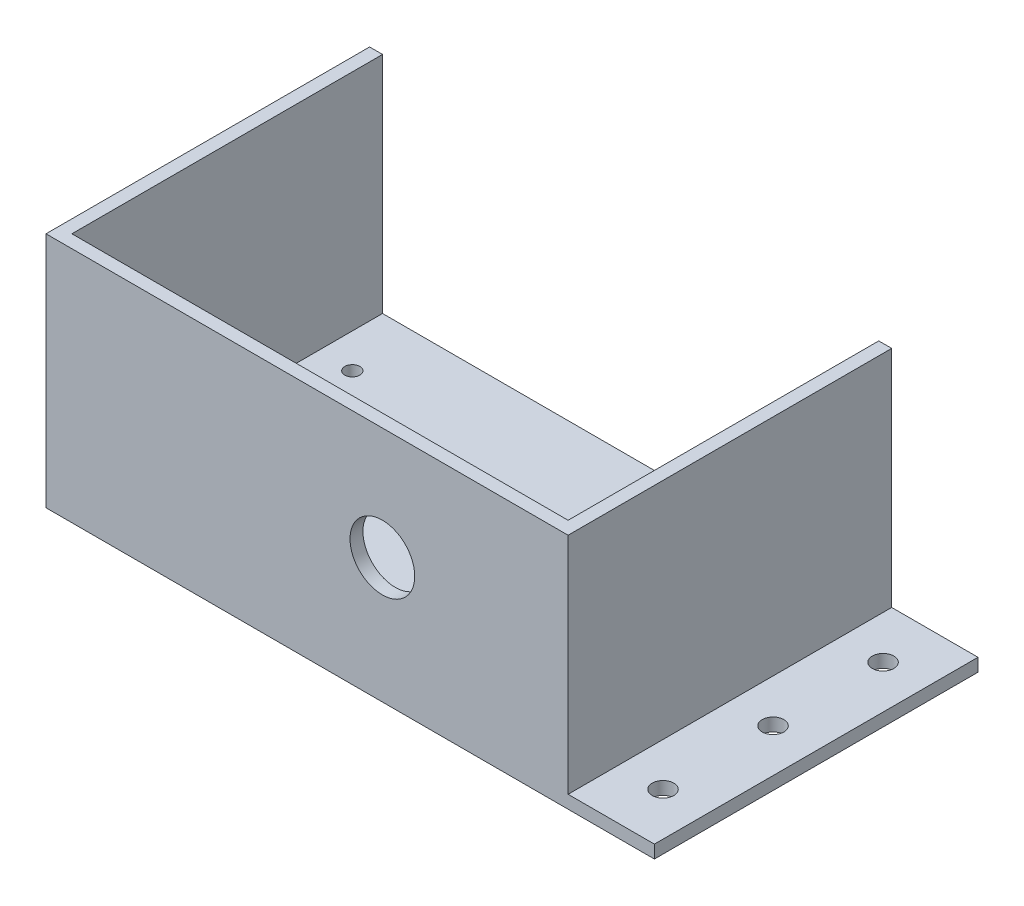
from build123d import *

# Parameters (mm, degrees)
SKETCH1_W           = 121
SKETCH1_H           = 75
BOSS_EXTRUDE1_DEPTH = 58
SKETCH2_W           = 115
SKETCH2_H           = 53
CUT_EXTRUDE1_DEPTH  = 72
SKETCH4_W           = 1.41025641
SKETCH4_H           = 10
BOSS_EXTRUDE2_DEPTH = 1.5
SKETCH5_R           = 1.489811861
SKETCH5_R_2         = 1.5
CUT_EXTRUDE2_DEPTH  = 5
SKETCH6_W           = 75
SKETCH6_H           = 3
BOSS_EXTRUDE3_DEPTH = 20
SKETCH7_R           = 2.5
CUT_EXTRUDE3_DEPTH  = 20
SKETCH8_R           = 7.5
CUT_EXTRUDE4_DEPTH  = 5
SKETCH9_R           = 1.75
CUT_EXTRUDE5_DEPTH  = 5
SKETCH10_W          = 121
SKETCH10_H          = 10.055013608
CUT_EXTRUDE6_DEPTH  = 171.429604315


with BuildPart() as part:
    # Sketch1 → Boss-Extrude1 (new body)
    with BuildSketch(Plane(origin=(0, 0, 0), x_dir=(1, 0, 0), z_dir=(0, 1, 0))):
        with Locations((60.5, 37.5)):
            Rectangle(SKETCH1_W, SKETCH1_H)
    extrude(amount=BOSS_EXTRUDE1_DEPTH)

    # Sketch2 → Cut-Extrude1 (cut)
    with BuildSketch(Plane(origin=(0, 0, -75), x_dir=(-1, 0, 0), z_dir=(0, 0, -1))):
        with Locations((-60.5, 29.5)):
            Rectangle(SKETCH2_W, SKETCH2_H)
    extrude(amount=-CUT_EXTRUDE1_DEPTH, mode=Mode.SUBTRACT)

    # Sketch4 → Boss-Extrude2 (add)
    # profile 1 of 9: a face of its own
    with BuildSketch(Plane(origin=(0, 58, 0), x_dir=(1, 0, 0), z_dir=(0, 1, 0))):
        with Locations((16.987179487, 60)):
            Rectangle(SKETCH4_W, SKETCH4_H)
    # profile 2 of 9: a face of its own
    with BuildSketch(Plane(origin=(0, 58, 0), x_dir=(1, 0, 0), z_dir=(0, 1, 0))):
        with BuildLine():
            Line((21.58974359, 55), (21.58974359, 65))
            Line((21.58974359, 65), (23.711137821, 65))
            Line((23.711137821, 65), (25.946714744, 57.982772436))
            add(Edge.make_bspline(
                [(25.946714744, 57.982772436), (25.971317363, 57.903279477), (26.018897396, 57.749544721), (26.08945294, 57.527537588), (26.153646657, 57.321231721), (26.211463207, 57.129970438), (26.266025433, 56.954703341), (26.313267723, 56.793992236), (26.358432889, 56.649622979), (26.384901695, 56.557871596), (26.397435897, 56.514423077)],
                knots=[0, 0, 0, 0, 1.300204174, 2.514519184, 3.639827924, 4.676153899, 5.636536826, 6.507959918, 7.293450077, 8, 8, 8, 8], degree=3))
            add(Edge.make_bspline(
                [(26.397435897, 56.514423077), (26.411396089, 56.561850935), (26.441104268, 56.662780451), (26.489265976, 56.821474812), (26.540511404, 56.997087981), (26.601836474, 57.186601452), (26.665760601, 57.392988098), (26.732857292, 57.61607652), (26.810252019, 57.853639448), (26.861684683, 58.018107915), (26.888221154, 58.102964744)],
                knots=[0, 0, 0, 0, 0.713638162, 1.518667645, 2.393860736, 3.354087503, 4.393659122, 5.512594909, 6.716633584, 8, 8, 8, 8], degree=3))
            Line((26.888221154, 58.102964744), (29.101762821, 65))
            Line((29.101762821, 65), (31.205128205, 65))
            Line((31.205128205, 65), (31.205128205, 55))
            Line((31.205128205, 55), (29.794871795, 55))
            Line((29.794871795, 55), (29.794871795, 63.461538462))
            Line((29.794871795, 63.461538462), (27.126602564, 55))
            Line((27.126602564, 55), (25.65224359, 55))
            Line((25.65224359, 55), (23, 63.461538462))
            Line((23, 63.461538462), (23, 55))
            Line((23, 55), (21.58974359, 55))
        make_face()
    # profile 3 of 9: a face of its own
    with BuildSketch(Plane(origin=(0, 58, 0), x_dir=(1, 0, 0), z_dir=(0, 1, 0))):
        Polygon((33.734375, 55), (37.704727564, 65), (39.295272436, 65), (43.265625, 55), (41.769230769, 55), (40.631410256, 58.076923077), (36.368589744, 58.076923077), (35.230769231, 55), align=None)
        with BuildLine():
            Line((36.793269231, 59.230769231), (40.206730769, 59.230769231))
            Line((40.206730769, 59.230769231), (39.235176282, 61.858974359))
            add(Edge.make_bspline(
                [(39.235176282, 61.858974359), (39.197930352, 61.960524623), (39.125107525, 62.159074565), (39.016506752, 62.447550868), (38.917290835, 62.721499806), (38.820001481, 62.976993344), (38.732176644, 63.217742781), (38.65122624, 63.442121964), (38.571166974, 63.648571351), (38.523122282, 63.781958927), (38.5, 63.846153846)],
                knots=[0, 0, 0, 0, 1.225184869, 2.395467751, 3.491410812, 4.525364584, 5.492066482, 6.394148129, 7.227157926, 8, 8, 8, 8], degree=3))
            add(Edge.make_bspline(
                [(38.5, 63.846153846), (38.461751283, 63.687854829), (38.385096138, 63.370604078), (38.224598927, 62.905789169), (38.040995692, 62.445225202), (37.891887987, 62.148440925), (37.816907051, 61.999198718)],
                knots=[0, 0, 0, 0, 0.9891762, 1.982431084, 2.985436691, 4, 4, 4, 4], degree=3))
            Line((37.816907051, 61.999198718), (36.793269231, 59.230769231))
        make_face(mode=Mode.SUBTRACT)
    # profile 4 of 9: a face of its own
    with BuildSketch(Plane(origin=(0, 58, 0), x_dir=(1, 0, 0), z_dir=(0, 1, 0))):
        with BuildLine():
            Line((50.794871795, 58.974358974), (50.794871795, 60.128205128))
            Line((50.794871795, 60.128205128), (54.897435897, 60.128205128))
            Line((54.897435897, 60.128205128), (54.897435897, 56.428285256))
            add(Edge.make_bspline(
                [(54.897435897, 56.428285256), (54.73556896, 56.305002849), (54.416994741, 56.062367775), (53.917376037, 55.745937247), (53.409562732, 55.477566549), (52.894958248, 55.256008429), (52.371793817, 55.085009754), (51.842328107, 54.962612928), (51.305984536, 54.885088148), (50.945369884, 54.876229875), (50.764823718, 54.871794872)],
                knots=[0, 0, 0, 0, 1.08433114, 2.134098231, 3.14842993, 4.143565882, 5.117308249, 6.078377492, 7.037916032, 8, 8, 8, 8], degree=3))
            add(Edge.make_bspline(
                [(50.764823718, 54.871794872), (50.64389522, 54.87365123), (50.40366656, 54.877338949), (50.047995823, 54.908887566), (49.700630006, 54.955764326), (49.362227986, 55.024694072), (49.031595068, 55.112449203), (48.709368093, 55.220898845), (48.395411996, 55.347451318), (48.091476855, 55.49253813), (47.802131001, 55.658770426), (47.528170608, 55.841031042), (47.273051762, 56.0420657), (47.036381783, 56.260230047), (46.819016407, 56.496822026), (46.617735084, 56.748697136), (46.437936839, 57.020470861), (46.275651434, 57.307144136), (46.132352841, 57.606547618), (46.007233593, 57.916126264), (45.903810689, 58.235137402), (45.817554604, 58.562169756), (45.748959138, 58.897100071), (45.701047331, 59.240978048), (45.672844116, 59.593540684), (45.668739297, 59.831680225), (45.666666667, 59.951923077)],
                knots=[0, 0, 0, 0, 1.072770755, 2.131096365, 3.165876834, 4.181397123, 5.193125461, 6.199217581, 7.195986042, 8.195005739, 9.184865672, 10.154356418, 11.112044544, 12.063776475, 13.007136321, 13.960176652, 14.921449994, 15.895149614, 16.88092309, 17.86448639, 18.855604391, 19.854360534, 20.864074582, 21.88711945, 22.933151623, 24, 24, 24, 24], degree=3))
            add(Edge.make_bspline(
                [(45.666666667, 59.951923077), (45.668744997, 60.071498178), (45.672872481, 60.308969721), (45.701316611, 60.662837854), (45.749403968, 61.01051012), (45.815790489, 61.352185335), (45.899570126, 61.687567122), (46.003941343, 62.016720404), (46.128812684, 62.339343656), (46.270237862, 62.654755101), (46.427750978, 62.958441784), (46.60863962, 63.240698377), (46.798821071, 63.508119853), (47.013985843, 63.749080405), (47.239158795, 63.976021204), (47.485357478, 64.178003002), (47.746376315, 64.361105929), (48.023344215, 64.523362037), (48.314631955, 64.664963992), (48.616763548, 64.789673635), (48.930424699, 64.893159395), (49.253817605, 64.980468389), (49.588734219, 65.045340341), (49.934311274, 65.094139841), (50.290939241, 65.12201267), (50.532405627, 65.126123852), (50.654647436, 65.128205128)],
                knots=[0, 0, 0, 0, 1.059979929, 2.105079288, 3.144800512, 4.169876923, 5.189194625, 6.207600986, 7.228841866, 8.254191695, 9.270945245, 10.257936415, 11.22408152, 12.176290364, 13.118065146, 14.055588944, 14.994904974, 15.942096138, 16.897776019, 17.864011786, 18.837383209, 19.823806203, 20.831455606, 21.859450402, 22.916351634, 24, 24, 24, 24], degree=3))
            add(Edge.make_bspline(
                [(50.654647436, 65.128205128), (50.831115136, 65.123959635), (51.175909745, 65.115664501), (51.68071161, 65.051149166), (52.158134205, 64.940754438), (52.536487652, 64.813922736), (52.8206613, 64.690323441), (53.021530624, 64.590430295), (53.21034398, 64.481348357), (53.389274769, 64.366622463), (53.554327508, 64.238724287), (53.707670997, 64.103667865), (53.84970877, 63.959833891), (54.024578118, 63.754555172), (54.224621182, 63.469402744), (54.425338507, 63.082182228), (54.601142318, 62.650536201), (54.688153937, 62.341423111), (54.733173077, 62.181490385)],
                knots=[0, 0, 0, 0, 1.539867261, 3.008697525, 4.432261777, 5.810773619, 6.484177873, 7.135742803, 7.767512201, 8.386601754, 8.989234153, 9.587908519, 10.168964172, 10.7517707, 11.940093668, 13.199243526, 14.550910222, 16, 16, 16, 16], degree=3))
            Line((54.733173077, 62.181490385), (53.443108974, 61.856971154))
            add(Edge.make_bspline(
                [(53.443108974, 61.856971154), (53.405874484, 61.975646851), (53.334562136, 62.202937264), (53.208953288, 62.520609667), (53.062629557, 62.794917237), (52.906173437, 63.03636924), (52.719779789, 63.244075818), (52.503369428, 63.428118249), (52.250462487, 63.587953021), (51.966628117, 63.724803039), (51.658050303, 63.836552659), (51.329620599, 63.916187516), (50.984682955, 63.965713987), (50.748968599, 63.971436756), (50.628605769, 63.974358974)],
                knots=[0, 0, 0, 0, 1.164883671, 2.23101188, 3.193404931, 4.072828119, 4.918883984, 5.797350418, 6.725503451, 7.712871826, 8.743577122, 9.793233972, 10.87315899, 12, 12, 12, 12], degree=3))
            add(Edge.make_bspline(
                [(50.628605769, 63.974358974), (50.486232797, 63.970769984), (50.21058126, 63.963821259), (49.811123469, 63.914008077), (49.441465873, 63.829030609), (49.102847471, 63.707944881), (48.796690432, 63.559104982), (48.518614342, 63.390799982), (48.273333297, 63.198120431), (48.059914961, 62.983524042), (47.874312424, 62.753957932), (47.708805657, 62.514669015), (47.564876039, 62.263726715), (47.488000882, 62.087442093), (47.449519231, 61.999198718)],
                knots=[0, 0, 0, 0, 1.282088634, 2.482280855, 3.618640035, 4.691464057, 5.71354971, 6.679981643, 7.61357903, 8.515091979, 9.399860987, 10.268958177, 11.133486685, 12, 12, 12, 12], degree=3))
            add(Edge.make_bspline(
                [(47.449519231, 61.999198718), (47.392055005, 61.843994267), (47.276389513, 61.5315947), (47.16339573, 61.039243874), (47.090456723, 60.528375998), (47.081479537, 60.180549305), (47.076923077, 60.00400641)],
                knots=[0, 0, 0, 0, 0.971932623, 1.956331326, 2.96271565, 4, 4, 4, 4], degree=3))
            add(Edge.make_bspline(
                [(47.076923077, 60.00400641), (47.077613597, 59.895781102), (47.078966349, 59.683764253), (47.103212206, 59.372463708), (47.134914439, 59.073836949), (47.186365485, 58.789348439), (47.247536072, 58.518150279), (47.323409115, 58.260094134), (47.416152527, 58.016468037), (47.519741217, 57.784886293), (47.638264501, 57.567850479), (47.770253043, 57.365591733), (47.915216958, 57.178217942), (48.072661906, 57.005522406), (48.240252343, 56.844036102), (48.423236889, 56.699921497), (48.619557882, 56.571085484), (48.89498827, 56.417657457), (49.258151731, 56.262770224), (49.70831801, 56.124579887), (50.173570392, 56.042505126), (50.488064727, 56.031293828), (50.646634615, 56.025641026)],
                knots=[0, 0, 0, 0, 1.070760406, 2.097653971, 3.088708526, 4.041547766, 4.95691435, 5.839291284, 6.700934147, 7.534993757, 8.348268852, 9.145600082, 9.922850605, 10.690119832, 11.456705726, 12.223547942, 12.991528328, 13.778467112, 15.341275849, 16.888285822, 18.431055468, 20, 20, 20, 20], degree=3))
            add(Edge.make_bspline(
                [(50.646634615, 56.025641026), (50.785735052, 56.030218875), (51.063294813, 56.039353473), (51.476523468, 56.102740525), (51.883255685, 56.210373903), (52.27650153, 56.355690977), (52.644357284, 56.52213959), (52.96997267, 56.700489064), (53.252725699, 56.878452619), (53.411773916, 57.014721263), (53.487179487, 57.079326923)],
                knots=[0, 0, 0, 0, 1.08078364, 2.156585965, 3.240205791, 4.344938036, 5.41078367, 6.374425311, 7.229306744, 8, 8, 8, 8], degree=3))
            Line((53.487179487, 57.079326923), (53.487179487, 58.974358974))
            Line((53.487179487, 58.974358974), (50.794871795, 58.974358974))
        make_face()
    # profile 5 of 9: a face of its own
    with BuildSketch(Plane(origin=(0, 58, 0), x_dir=(1, 0, 0), z_dir=(0, 1, 0))):
        with Locations((59.628205128, 60)):
            Rectangle(SKETCH4_W, SKETCH4_H)
    # profile 6 of 9: a face of its own
    with BuildSketch(Plane(origin=(0, 58, 0), x_dir=(1, 0, 0), z_dir=(0, 1, 0))):
        Polygon((64.487179487, 55), (64.487179487, 65), (65.977564103, 65), (70.769230769, 57.538060897), (70.769230769, 65), (72.179487179, 65), (72.179487179, 55), (70.689102564, 55), (65.897435897, 62.461939103), (65.897435897, 55), align=None)
    # profile 7 of 9: a face of its own
    with BuildSketch(Plane(origin=(0, 58, 0), x_dir=(1, 0, 0), z_dir=(0, 1, 0))):
        Polygon((76.333333333, 55), (76.333333333, 65), (83.384615385, 65), (83.384615385, 63.846153846), (77.743589744, 63.846153846), (77.743589744, 60.769230769), (83, 60.769230769), (83, 59.615384615), (77.743589744, 59.615384615), (77.743589744, 56.153846154), (83.641025641, 56.153846154), (83.641025641, 55), align=None)
    # profile 8 of 9: a face of its own
    with BuildSketch(Plane(origin=(0, 58, 0), x_dir=(1, 0, 0), z_dir=(0, 1, 0))):
        Polygon((87.41025641, 55), (87.41025641, 65), (94.461538462, 65), (94.461538462, 63.846153846), (88.820512821, 63.846153846), (88.820512821, 60.769230769), (94.076923077, 60.769230769), (94.076923077, 59.615384615), (88.820512821, 59.615384615), (88.820512821, 56.153846154), (94.717948718, 56.153846154), (94.717948718, 55), align=None)
    # profile 9 of 9: a face of its own
    with BuildSketch(Plane(origin=(0, 58, 0), x_dir=(1, 0, 0), z_dir=(0, 1, 0))):
        with BuildLine():
            Line((98.487179487, 55), (98.487179487, 65))
            Line((98.487179487, 65), (102.826121795, 65))
            add(Edge.make_bspline(
                [(102.826121795, 65), (102.9282906, 64.999199465), (103.126026365, 64.997650124), (103.412784052, 64.986682545), (103.680443606, 64.963039323), (103.929497162, 64.937472473), (104.159900472, 64.898230774), (104.371415834, 64.853221431), (104.564369817, 64.799659632), (104.739625043, 64.736399019), (104.902223679, 64.664829112), (105.052940331, 64.576523403), (105.198040099, 64.479759173), (105.332137823, 64.366075645), (105.458770343, 64.241602704), (105.577820293, 64.104649027), (105.687525233, 63.954026134), (105.822833139, 63.738453539), (105.967990935, 63.451356238), (106.088930179, 63.083933901), (106.16690964, 62.699596725), (106.175253665, 62.436946788), (106.179487179, 62.303685897)],
                knots=[0, 0, 0, 0, 1.242255013, 2.404239178, 3.487702428, 4.508875116, 5.447164253, 6.327763259, 7.137389581, 7.87956647, 8.591787438, 9.293660819, 10.000726923, 10.709654955, 11.427269343, 12.158170644, 12.913245971, 13.690346794, 15.251572448, 16.809945773, 18.381459854, 20, 20, 20, 20], degree=3))
            add(Edge.make_bspline(
                [(106.179487179, 62.303685897), (106.177530353, 62.21814429), (106.173665487, 62.04919375), (106.144060224, 61.800791233), (106.090491892, 61.563452617), (106.021801064, 61.335099332), (105.927784275, 61.118966781), (105.818869907, 60.910640388), (105.683940489, 60.715843438), (105.532872085, 60.529388798), (105.359637137, 60.355269829), (105.162711701, 60.199768316), (104.944047853, 60.059894394), (104.702615774, 59.939507239), (104.44119459, 59.829467663), (104.156504185, 59.740858495), (103.849693543, 59.668502315), (103.636998145, 59.63346466), (103.52724359, 59.615384615)],
                knots=[0, 0, 0, 0, 0.982609109, 1.940720374, 2.867584677, 3.775009516, 4.675469332, 5.571146231, 6.471115823, 7.392408543, 8.32534739, 9.286126426, 10.269214477, 11.301811357, 12.381622301, 13.524260118, 14.722474812, 16, 16, 16, 16], degree=3))
            add(Edge.make_bspline(
                [(103.52724359, 59.615384615), (103.607752714, 59.574713182), (103.760642439, 59.497476665), (103.972320158, 59.376370478), (104.151752032, 59.252629797), (104.25570601, 59.164126826), (104.304487179, 59.122596154)],
                knots=[0, 0, 0, 0, 1.172304973, 2.226249348, 3.167654437, 4, 4, 4, 4], degree=3))
            add(Edge.make_bspline(
                [(104.304487179, 59.122596154), (104.398954671, 59.029990406), (104.59299761, 58.83977162), (104.860397207, 58.515773306), (105.119650301, 58.155113465), (105.277166103, 57.894463376), (105.358173077, 57.760416667)],
                knots=[0, 0, 0, 0, 0.918110279, 1.885863737, 2.912745394, 4, 4, 4, 4], degree=3))
            Line((105.358173077, 57.760416667), (106.998798077, 55))
            Line((106.998798077, 55), (105.382211538, 55))
            Line((105.382211538, 55), (104.136217949, 57.111378205))
            add(Edge.make_bspline(
                [(104.136217949, 57.111378205), (104.091418278, 57.185458447), (104.004603872, 57.329013793), (103.879203572, 57.538669464), (103.756252701, 57.731690915), (103.642217872, 57.913594803), (103.532471359, 58.081078753), (103.428073571, 58.234724571), (103.331897581, 58.376547891), (103.212771184, 58.541667143), (103.074127843, 58.724373128), (102.912340577, 58.912525791), (102.758271131, 59.062537403), (102.568531766, 59.209639746), (102.333510857, 59.347229261), (102.133738647, 59.410447864), (102.036858974, 59.441105769)],
                knots=[0, 0, 0, 0, 1.130940588, 2.191577161, 3.191089816, 4.120344442, 4.99615009, 5.80661983, 6.546979556, 7.234477901, 8.466216387, 9.541989141, 10.473533583, 11.269175393, 12.675684693, 14, 14, 14, 14], degree=3))
            add(Edge.make_bspline(
                [(102.036858974, 59.441105769), (101.996211854, 59.448435826), (101.90341326, 59.465170567), (101.74584148, 59.476100052), (101.554923936, 59.487700239), (101.416562739, 59.487362249), (101.341746795, 59.487179487)],
                knots=[0, 0, 0, 0, 0.709978628, 1.620902492, 2.713552433, 4, 4, 4, 4], degree=3))
            Line((101.341746795, 59.487179487), (99.897435897, 59.487179487))
            Line((99.897435897, 59.487179487), (99.897435897, 55))
            Line((99.897435897, 55), (98.487179487, 55))
        make_face()
        with BuildLine():
            Line((99.897435897, 60.641025641), (102.575721154, 60.641025641))
            add(Edge.make_bspline(
                [(102.575721154, 60.641025641), (102.710020522, 60.643126882), (102.961080593, 60.647054955), (103.312148386, 60.680596569), (103.611336258, 60.733895618), (103.864558726, 60.811638523), (104.07730557, 60.919571492), (104.262335542, 61.051107984), (104.416097778, 61.215871133), (104.544012075, 61.401771268), (104.643442482, 61.606345087), (104.715166835, 61.82121989), (104.762111672, 62.044589794), (104.766836719, 62.196612258), (104.769230769, 62.273637821)],
                knots=[0, 0, 0, 0, 1.546323217, 2.890706218, 4.056530419, 5.041445823, 5.928701482, 6.793137403, 7.641659452, 8.509781392, 9.383301667, 10.251423607, 11.114044887, 12, 12, 12, 12], degree=3))
            add(Edge.make_bspline(
                [(104.769230769, 62.273637821), (104.767369495, 62.329769277), (104.763723806, 62.43971431), (104.744611897, 62.601083093), (104.707453809, 62.754420737), (104.658386644, 62.9005378), (104.592822956, 63.03836408), (104.514935969, 63.168967578), (104.421992748, 63.291624437), (104.315531637, 63.406708289), (104.193294934, 63.511423347), (104.053671883, 63.601769729), (103.897763681, 63.678544664), (103.725389111, 63.739478385), (103.537091185, 63.788215443), (103.331797963, 63.820638635), (103.110448296, 63.844099949), (102.957065813, 63.845456423), (102.878205128, 63.846153846)],
                knots=[0, 0, 0, 0, 0.965208469, 1.890559848, 2.786986821, 3.67262109, 4.535197034, 5.405224191, 6.282113641, 7.175449223, 8.095446547, 9.040936516, 10.026471658, 11.075712529, 12.17809725, 13.364958037, 14.645208957, 16, 16, 16, 16], degree=3))
            Line((102.878205128, 63.846153846), (99.897435897, 63.846153846))
            Line((99.897435897, 63.846153846), (99.897435897, 60.641025641))
        make_face(mode=Mode.SUBTRACT)
    extrude(amount=BOSS_EXTRUDE2_DEPTH)

    # Sketch5 → Cut-Extrude2 (cut)
    with BuildSketch(Plane(origin=(0, 58, 0), x_dir=(-1, 0, 0), z_dir=(0, 1, 0))):
        with Locations(Location((-60.478143675, -46.04301681, 0), (0, 0, 90))):
            Circle(SKETCH5_R)
        with Locations(Location((-60.506522325, -6.250393675, 0), (0, 0, 90))):
            Circle(SKETCH5_R_2)
        Polygon((-84.629004206, -12.253075019), (-42.629004206, -12.253075019), (-36.329004969, -18.153076545), (-36.329004969, -34.153074638), (-42.629004206, -40.05307521), (-84.629004206, -40.05307521), align=None)
    extrude(amount=-CUT_EXTRUDE2_DEPTH, mode=Mode.SUBTRACT)

    # Sketch6 → Boss-Extrude3 (add)
    with BuildSketch(Plane(origin=(121, 0, 0), x_dir=(0, 0, -1), z_dir=(1, 0, 0))):
        with Locations((37.5, 1.5)):
            Rectangle(SKETCH6_W, SKETCH6_H)
    extrude(amount=BOSS_EXTRUDE3_DEPTH)

    # Sketch7 → Cut-Extrude3 (cut)
    with BuildSketch(Plane(origin=(0, 3, 0), x_dir=(1, 0, 0), z_dir=(0, 1, 0))):
        with Locations(Location((131, 63, 0), (0, 0, 270))):
            Circle(SKETCH7_R)
        with Locations(Location((131, 37.5, 0), (0, 0, 270))):
            Circle(SKETCH7_R)
        with Locations(Location((131, 12, 0), (0, 0, 270))):
            Circle(SKETCH7_R)
    extrude(amount=-CUT_EXTRUDE3_DEPTH, mode=Mode.SUBTRACT)

    # Sketch8 → Cut-Extrude4 (cut)
    with BuildSketch(Plane.XY):
        with Locations((77.955583756, 29)):
            Circle(SKETCH8_R)
    extrude(amount=-CUT_EXTRUDE4_DEPTH, mode=Mode.SUBTRACT)

    # Sketch9 → Cut-Extrude5 (cut)
    with BuildSketch(Plane.XZ):
        with Locations(Location((11, -60, 0), (0, 0, 270))):
            Circle(SKETCH9_R)
        with Locations(Location((110, -60, 0), (0, 0, 270))):
            Circle(SKETCH9_R)
    extrude(amount=-CUT_EXTRUDE5_DEPTH, mode=Mode.SUBTRACT)

    # Sketch10 → Cut-Extrude6 (cut, through all)
    with BuildSketch(Plane.XY):
        with Locations((60.5, 60.027506804)):
            Rectangle(SKETCH10_W, SKETCH10_H)
    extrude(amount=-CUT_EXTRUDE6_DEPTH, mode=Mode.SUBTRACT)


solid = part.part
